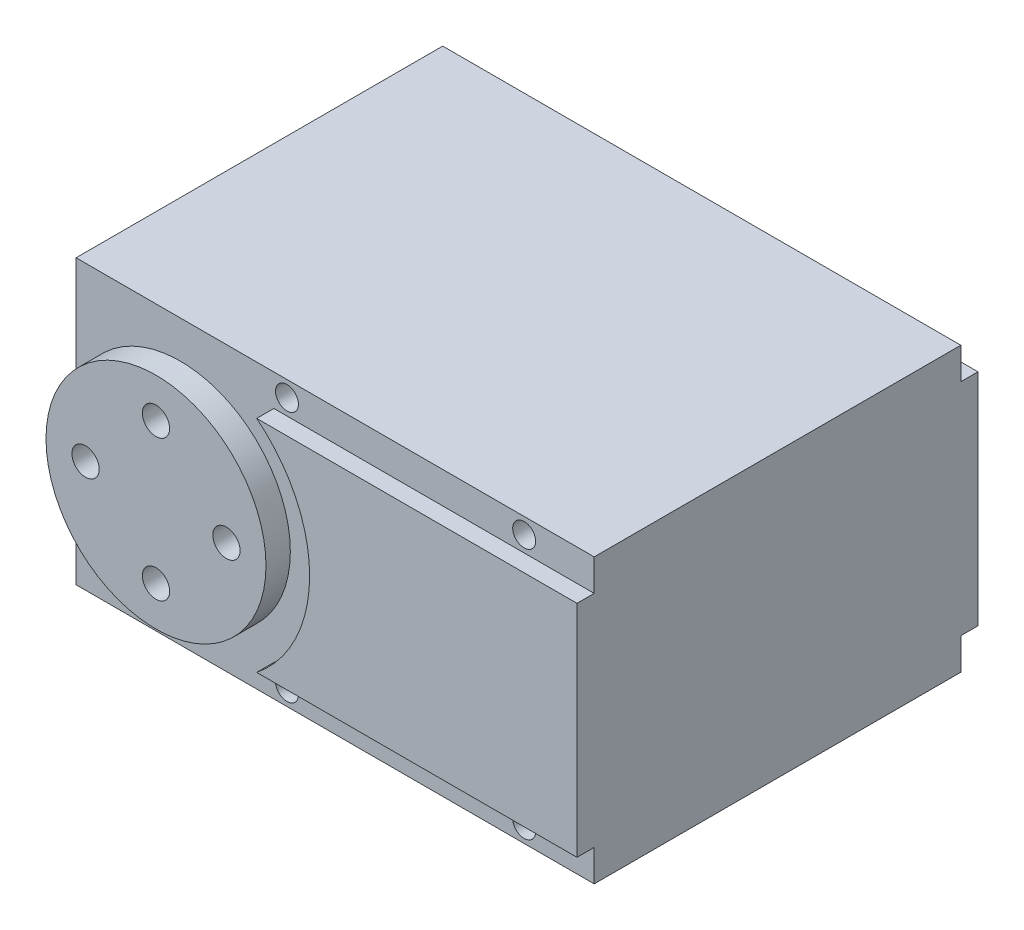
from build123d import *

# Parameters (mm, degrees)
BOSS_EXTRUDE1_DEPTH             = 17.5
BOSS_EXTRUDE1_DEPTH_BACK        = 17.5
BOSS_EXTRUDE2_DEPTH             = 16
BOSS_EXTRUDE2_DEPTH_BACK        = 16
SKETCH1_3_R                     = 1
SKETCH1_3_W                     = 27.956190476
SKETCH1_3_H                     = 2.76
BOSS_EXTRUDE3_DEPTH             = 18.625
BOSS_EXTRUDE3_DEPTH_BACK        = 18.625
TAP_DRILL_FOR_2_HELICOIL1_D     = 2.38252
TAP_DRILL_FOR_2_HELICOIL1_DEPTH = 5
TAP_DRILL_FOR_2_HELICOIL1_TIP   = 0.715781221
SKETCH6_R                       = 9.6
SKETCH6_R_2                     = 4
CUT_EXTRUDE1_DEPTH              = 0.5


with BuildPart() as part:
    # Sketch1 → Boss-Extrude1 (new, two sides: drawn at the far end of the back side and taken through both)
    with BuildSketch(Plane.XY.offset(-BOSS_EXTRUDE1_DEPTH_BACK)):
        with BuildLine():
            Line((22.61, 0), (-0.726109068, 0))
            ThreePointArc((-0.726109068, 0), (-1.941229139, -5.326939839), (-5.346190476, -9.6))
            Line((-5.346190476, -9.6), (22.61, -9.6))
            Line((22.61, -9.6), (22.61, 0))
        make_face()
        with BuildLine():
            Line((22.61, 9.6), (-5.346190476, 9.6))
            ThreePointArc((-5.346190476, 9.6), (-1.941229139, 5.326939839), (-0.726109068, 0))
            Line((-0.726109068, 0), (22.61, 0))
            Line((22.61, 0), (22.61, 9.6))
        make_face()
    extrude(amount=BOSS_EXTRUDE1_DEPTH + BOSS_EXTRUDE1_DEPTH_BACK)

    # Sketch1<3> → Boss-Extrude2 (add, two sides: drawn at the far end of the back side and taken through both)
    # profile 1 of 7: a face of its own
    with BuildSketch(Plane.XY.offset(-BOSS_EXTRUDE2_DEPTH_BACK)):
        with BuildLine():
            ThreePointArc((-5.346190476, -9.6), (-1.941229139, -5.326939839), (-0.726109068, 0))
            Line((-0.726109068, 0), (-3.41, 0))
            ThreePointArc((-3.41, 0), (-13.01, -9.6), (-22.61, 0))
            Line((-22.61, 0), (-22.61, -12.36))
            Line((-22.61, -12.36), (-5.346190476, -12.36))
            Line((-5.346190476, -12.36), (-5.346190476, -9.6))
        make_face()
    # profile 2 of 7: a face of its own
    with BuildSketch(Plane.XY.offset(-BOSS_EXTRUDE2_DEPTH_BACK)):
        with BuildLine():
            ThreePointArc((-22.61, 0), (-13.01, -9.6), (-3.41, 0))
            Line((-3.41, 0), (-22.61, 0))
        make_face()
    # profile 3 of 7: a face of its own
    with BuildSketch(Plane.XY.offset(-BOSS_EXTRUDE2_DEPTH_BACK)):
        with BuildLine():
            Line((-22.61, 0), (-3.41, 0))
            ThreePointArc((-3.41, 0), (-13.01, 9.6), (-22.61, 0))
        make_face()
    # profile 4 of 7: a face of its own
    with BuildSketch(Plane.XY.offset(-BOSS_EXTRUDE2_DEPTH_BACK)):
        with BuildLine():
            ThreePointArc((-22.61, 0), (-13.01, -9.6), (-3.41, 0))
            Line((-3.41, 0), (-22.61, 0))
        make_face()
    # profile 5 of 7: a face of its own
    with BuildSketch(Plane.XY.offset(-BOSS_EXTRUDE2_DEPTH_BACK)):
        with BuildLine():
            Line((-22.61, 0), (-3.41, 0))
            ThreePointArc((-3.41, 0), (-13.01, 9.6), (-22.61, 0))
        make_face()
    # profile 6 of 7: a face of its own
    with BuildSketch(Plane.XY.offset(-BOSS_EXTRUDE2_DEPTH_BACK)):
        with BuildLine():
            ThreePointArc((-0.726109068, 0), (-1.941229139, 5.326939839), (-5.346190476, 9.6))
            Line((-5.346190476, 9.6), (22.61, 9.6))
            Line((22.61, 9.6), (22.61, 12.36))
            Line((22.61, 12.36), (-22.61, 12.36))
            Line((-22.61, 12.36), (-22.61, 0))
            ThreePointArc((-22.61, 0), (-13.01, 9.6), (-3.41, 0))
            Line((-3.41, 0), (-0.726109068, 0))
        make_face()
        with Locations((-4.2, 10.98)):
            Circle(SKETCH1_3_R, mode=Mode.SUBTRACT)
        with Locations((16.5, 10.98)):
            Circle(SKETCH1_3_R, mode=Mode.SUBTRACT)
    # profile 7 of 7: a face of its own
    with BuildSketch(Plane.XY.offset(-BOSS_EXTRUDE2_DEPTH_BACK)):
        with Locations((8.631904762, -10.98)):
            Rectangle(SKETCH1_3_W, SKETCH1_3_H)
        with Locations((-4.2, -10.98)):
            Circle(SKETCH1_3_R, mode=Mode.SUBTRACT)
        with Locations((16.5, -10.98)):
            Circle(SKETCH1_3_R, mode=Mode.SUBTRACT)
    extrude(amount=BOSS_EXTRUDE2_DEPTH + BOSS_EXTRUDE2_DEPTH_BACK)

    # Sketch1<4> → Boss-Extrude3 (add, two sides: drawn at the far end of the back side and taken through both)
    with BuildSketch(Plane.XY.offset(-BOSS_EXTRUDE3_DEPTH_BACK)):
        with BuildLine():
            ThreePointArc((-22.61, 0), (-13.01, -9.6), (-3.41, 0))
            Line((-3.41, 0), (-22.61, 0))
        make_face()
        with BuildLine():
            Line((-22.61, 0), (-3.41, 0))
            ThreePointArc((-3.41, 0), (-13.01, 9.6), (-22.61, 0))
        make_face()
    extrude(amount=BOSS_EXTRUDE3_DEPTH + BOSS_EXTRUDE3_DEPTH_BACK)

    # Tap Drill for #2 Helicoil1
    with Locations(Plane.XY.offset(18.625)):
        with Locations((-13.01, 6.148263222), (-6.861736778, 0), (-13.01, -6.148263222), (-19.158263222, 0)):
            Hole(TAP_DRILL_FOR_2_HELICOIL1_D / 2, depth=TAP_DRILL_FOR_2_HELICOIL1_DEPTH)
            with Locations((0, 0, -(TAP_DRILL_FOR_2_HELICOIL1_DEPTH + TAP_DRILL_FOR_2_HELICOIL1_TIP / 2))):  # 118° drill point
                Cone(0, TAP_DRILL_FOR_2_HELICOIL1_D / 2, TAP_DRILL_FOR_2_HELICOIL1_TIP, mode=Mode.SUBTRACT)

    # Sketch6 → Cut-Extrude1 (cut)
    with BuildSketch(Plane.XY.offset(16)):
        with Locations((-13.01, 0)):
            Circle(SKETCH6_R)
        with Locations((-13.01, 0)):
            Circle(SKETCH6_R_2, mode=Mode.SUBTRACT)
    extrude(amount=CUT_EXTRUDE1_DEPTH, mode=Mode.SUBTRACT)


solid = part.part
